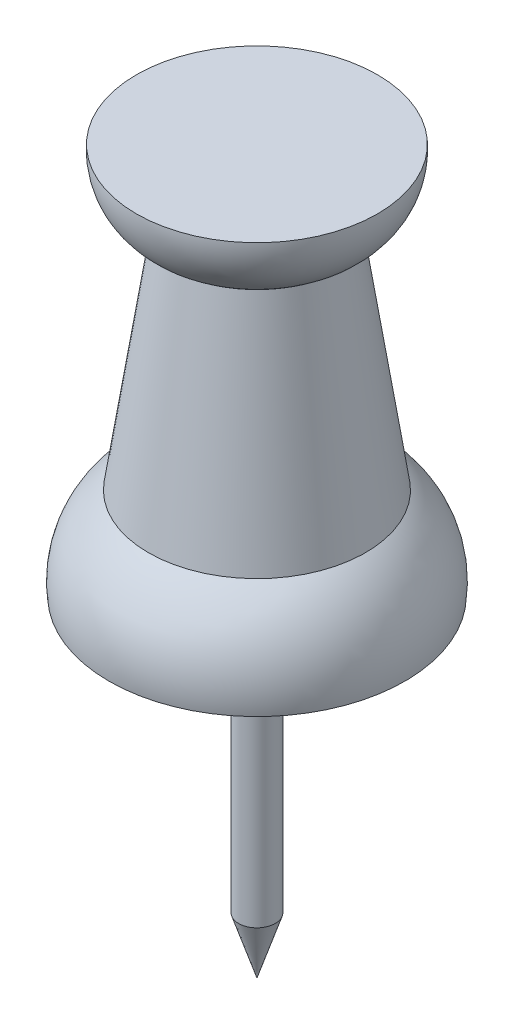
from build123d import *


with BuildPart() as part:
    # Sketch1 → Revolve1 (revolve)
    with BuildSketch(Plane.XY, mode=Mode.PRIVATE) as revolve1_sk:
        with BuildLine():
            Line((0, 7.09537037), (3.95, 7.09537037))
            ThreePointArc((3.95, 7.09537037), (3.576139111, 5.694289828), (2.438271605, 4.79537037))
            Line((2.438271605, 4.79537037), (3.557723263, -2.714506173))
            ThreePointArc((3.557723263, -2.714506173), (4.615478693, -4.037198455), (4.85, -5.714506173))
            Line((4.85, -5.714506173), (0.6, -5.714506173))
            Line((0.6, -5.714506173), (0.6, -14.714506173))
            Line((0.6, -14.714506173), (0, -16.561116295))
            Line((0, -16.561116295), (0, 7.09537037))
        make_face()
    revolve(revolve1_sk.sketch.rotate(Axis((0, 7.09537037, 0), (0, -1, 0)), 90), axis=Axis((0, 7.09537037, 0), (0, -1, 0)))


solid = part.part
